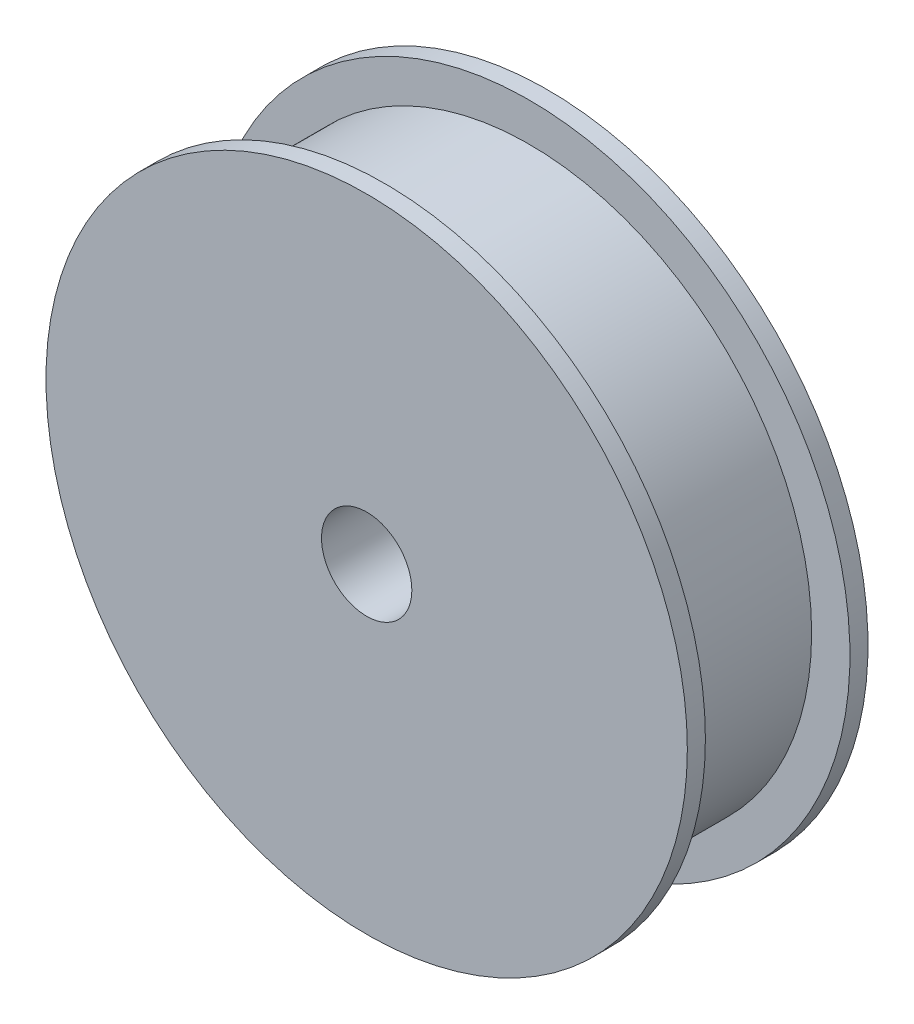
from build123d import *

# Parameters (mm, degrees)
SKETCH_1_R          = 31.26
EXTRUDE_1_DEPTH     = 16
SKETCH_2_R          = 5
CUT_EXTRUDE_1_DEPTH = 16
EXTRUDE_START       = 2
SKETCH_3_R          = 35.5
SKETCH_3_R_2        = 5
EXTRUDE_2_DEPTH     = 2
SKETCH_4_R          = 35.5
SKETCH_4_R_2        = 5
EXTRUDE_3_DEPTH     = 2


with BuildPart() as part:
    # 草图1 → 凸台-拉伸1 (new body)
    with BuildSketch(Plane.XY):
        Circle(SKETCH_1_R)
    extrude(amount=EXTRUDE_1_DEPTH)

    # 草图2 → 切除-拉伸1 (cut)
    with BuildSketch(Plane.XY.offset(16)):
        Circle(SKETCH_2_R)
    extrude(amount=-CUT_EXTRUDE_1_DEPTH, mode=Mode.SUBTRACT)

    # 草图3 → 凸台-拉伸2 (add)
    with BuildSketch(Plane.XY.offset(16).offset(EXTRUDE_START)):
        Circle(SKETCH_3_R)
        Circle(SKETCH_3_R_2, mode=Mode.SUBTRACT)
    extrude(amount=-EXTRUDE_2_DEPTH)

    # 草图4 → 凸台-拉伸3 (add)
    with BuildSketch(Plane(origin=(0, 0, 0), x_dir=(-1, 0, 0), z_dir=(0, 0, -1))):
        with Locations(Location((0, 0, 0), (0, 0, 180))):
            Circle(SKETCH_4_R)
        with Locations(Location((0, 0, 0), (0, 0, 180))):
            Circle(SKETCH_4_R_2, mode=Mode.SUBTRACT)
    extrude(amount=EXTRUDE_3_DEPTH)


solid = part.part
